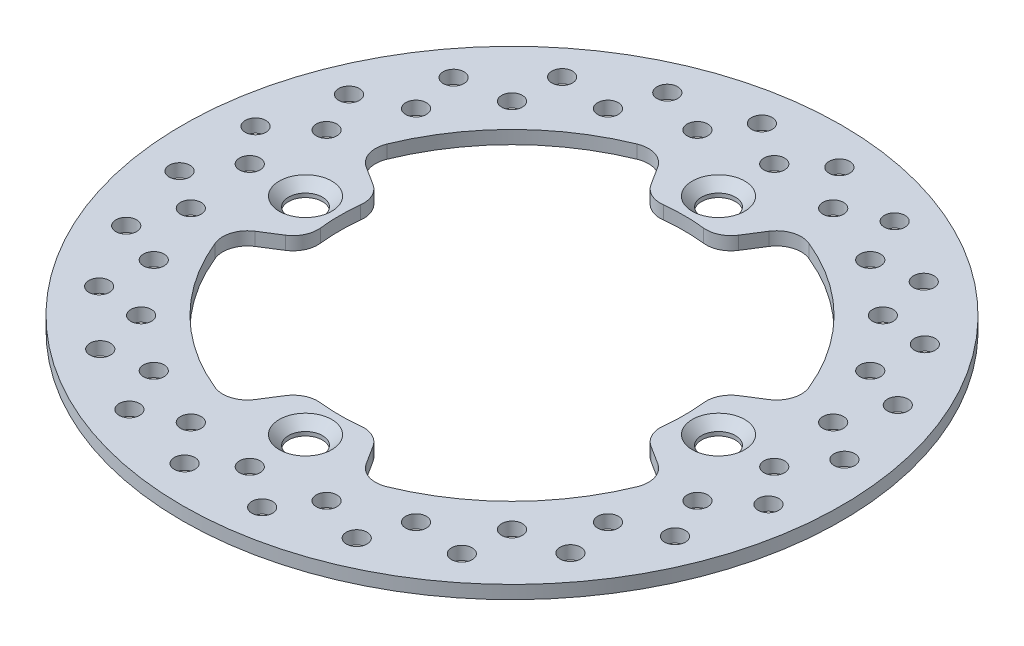
from build123d import *

# Parameters (mm, degrees)
SKETCH1_R                                 = 101.346
SKETCH1_R_2                               = 5.207
BOSS_EXTRUDE1_DEPTH                       = 4.064
CSK_FOR_0_FLAT_HEAD_MACHINE_SCREW_2_COUNT = 2
CSK_FOR_0_FLAT_HEAD_MACHINE_SCREW_2_PITCH = 89.802561211
CSK_FOR_0_FLAT_HEAD_MACHINE_SCREW_3_COUNT = 2
CSK_FOR_0_FLAT_HEAD_MACHINE_SCREW_3_PITCH = 127
CSK_FOR_0_FLAT_HEAD_MACHINE_SCREW_4_COUNT = 2
CSK_FOR_0_FLAT_HEAD_MACHINE_SCREW_4_PITCH = 89.802561211
SKETCH5_R                                 = 3.175
CUT_EXTRUDE1_DEPTH                        = 144.382493802
CIRPATTERN1_COUNT                         = 24


with BuildPart() as part:
    # Sketch1 → Boss-Extrude1 (new body)
    with BuildSketch(Plane(origin=(0, 0, 0), x_dir=(1, 0, 0), z_dir=(0, 1, 0))):
        with Locations(Location((0, 0, 0), (0, 0, 270))):
            Circle(SKETCH1_R)
        with Locations(Location((-63.5, 0, 0), (0, 0, 270))):
            Circle(SKETCH1_R_2, mode=Mode.SUBTRACT)
        with Locations(Location((0, -63.5, 0), (0, 0, 270))):
            Circle(SKETCH1_R_2, mode=Mode.SUBTRACT)
        with Locations(Location((63.5, 0, 0), (0, 0, 270))):
            Circle(SKETCH1_R_2, mode=Mode.SUBTRACT)
        with Locations(Location((0, 63.5, 0), (0, 0, 270))):
            Circle(SKETCH1_R_2, mode=Mode.SUBTRACT)
        with BuildLine():
            ThreePointArc((64.881683525, 26.382546942), (49.526112508, 49.526112508), (26.382546942, 64.881683525))
            ThreePointArc((26.382546942, 64.881683525), (21.186364668, 65.079276457), (17.073311073, 61.897744859))
            Line((17.073311073, 61.897744859), (13.481082332, 56.221349199))
            ThreePointArc((13.481082332, 56.221349199), (10.323291769, 53.41878705), (6.158167064, 52.72760543))
            ThreePointArc((6.158167064, 52.72760543), (0, 53.086), (-6.158167064, 52.72760543))
            ThreePointArc((-6.158167064, 52.72760543), (-10.323291769, 53.41878705), (-13.481082332, 56.221349199))
            Line((-13.481082332, 56.221349199), (-17.073311073, 61.897744859))
            ThreePointArc((-17.073311073, 61.897744859), (-21.186364668, 65.079276457), (-26.382546942, 64.881683525))
            ThreePointArc((-26.382546942, 64.881683525), (-49.526112508, 49.526112508), (-64.881683525, 26.382546942))
            ThreePointArc((-64.881683525, 26.382546942), (-65.079276457, 21.186364668), (-61.897744859, 17.073311073))
            Line((-61.897744859, 17.073311073), (-56.221349199, 13.481082332))
            ThreePointArc((-56.221349199, 13.481082332), (-53.41878705, 10.323291769), (-52.72760543, 6.158167064))
            ThreePointArc((-52.72760543, 6.158167064), (-53.086, 0), (-52.72760543, -6.158167064))
            ThreePointArc((-52.72760543, -6.158167064), (-53.41878705, -10.323291769), (-56.221349199, -13.481082332))
            Line((-56.221349199, -13.481082332), (-61.897744859, -17.073311073))
            ThreePointArc((-61.897744859, -17.073311073), (-65.079276457, -21.186364668), (-64.881683525, -26.382546942))
            ThreePointArc((-64.881683525, -26.382546942), (-49.526112508, -49.526112508), (-26.382546942, -64.881683525))
            ThreePointArc((-26.382546942, -64.881683525), (-21.186364668, -65.079276457), (-17.073311073, -61.897744859))
            Line((-17.073311073, -61.897744859), (-13.481082332, -56.221349199))
            ThreePointArc((-13.481082332, -56.221349199), (-10.323291769, -53.41878705), (-6.158167064, -52.72760543))
            ThreePointArc((-6.158167064, -52.72760543), (0, -53.086), (6.158167064, -52.72760543))
            ThreePointArc((6.158167064, -52.72760543), (10.323291769, -53.41878705), (13.481082332, -56.221349199))
            Line((13.481082332, -56.221349199), (17.073311073, -61.897744859))
            ThreePointArc((17.073311073, -61.897744859), (21.186364668, -65.079276457), (26.382546942, -64.881683525))
            ThreePointArc((26.382546942, -64.881683525), (49.526112508, -49.526112508), (64.881683525, -26.382546942))
            ThreePointArc((64.881683525, -26.382546942), (65.079276457, -21.186364668), (61.897744859, -17.073311073))
            Line((61.897744859, -17.073311073), (56.221349199, -13.481082332))
            ThreePointArc((56.221349199, -13.481082332), (53.41878705, -10.323291769), (52.72760543, -6.158167064))
            ThreePointArc((52.72760543, -6.158167064), (53.086, 0), (52.72760543, 6.158167064))
            ThreePointArc((52.72760543, 6.158167064), (53.41878705, 10.323291769), (56.221349199, 13.481082332))
            Line((56.221349199, 13.481082332), (61.897744859, 17.073311073))
            ThreePointArc((61.897744859, 17.073311073), (65.079276457, 21.186364668), (64.881683525, 26.382546942))
        make_face(mode=Mode.SUBTRACT)
    extrude(amount=BOSS_EXTRUDE1_DEPTH)

    # Sketch4 → CSK for #0 Flat Head Machine Screw (100)1 (revolve, cut)
    with BuildSketch(Plane(origin=(0, 4.064, -63.5), x_dir=(0, 0, 1), z_dir=(1, 0, 0))):
        Polygon((0, 0), (0, 4.064), (5.08, 4.064), (5.08, 2.9845), (8.0645, 0), align=None)
    csk_for_0_flat_head_machine_screw_100 = revolve(axis=Axis((0, 10.414, -63.5), (0, -1, 0)), mode=Mode.SUBTRACT)

    # CSK for _0 Flat Head Machine Screw _ 2: CSK for #0 Flat Head Machine Screw (100)1 ×2
    with Locations(*[Vector(0.7071067811865462, 0, 0.7071067811865488) * (i * CSK_FOR_0_FLAT_HEAD_MACHINE_SCREW_2_PITCH) for i in range(1, CSK_FOR_0_FLAT_HEAD_MACHINE_SCREW_2_COUNT)]):
        add(csk_for_0_flat_head_machine_screw_100, mode=Mode.SUBTRACT)

    # CSK for _0 Flat Head Machine Screw _ 3: CSK for #0 Flat Head Machine Screw (100)1 ×2
    with Locations(*[(0, 0, i * CSK_FOR_0_FLAT_HEAD_MACHINE_SCREW_3_PITCH) for i in range(1, CSK_FOR_0_FLAT_HEAD_MACHINE_SCREW_3_COUNT)]):
        add(csk_for_0_flat_head_machine_screw_100, mode=Mode.SUBTRACT)

    # CSK for _0 Flat Head Machine Screw _ 4: CSK for #0 Flat Head Machine Screw (100)1 ×2
    with Locations(*[Vector(-0.7071067811865512, 0, 0.7071067811865438) * (i * CSK_FOR_0_FLAT_HEAD_MACHINE_SCREW_4_PITCH) for i in range(1, CSK_FOR_0_FLAT_HEAD_MACHINE_SCREW_4_COUNT)]):
        add(csk_for_0_flat_head_machine_screw_100, mode=Mode.SUBTRACT)

    # Sketch5 → Cut-Extrude1 (cut, through all)
    with BuildSketch(Plane(origin=(0, 4.064, 0), x_dir=(1, 0, 0), z_dir=(0, 1, 0))):
        with Locations(Location((80.645, 0, 0), (0, 0, 270))):
            Circle(SKETCH5_R)
        with Locations(Location((89.535, 12.7, 0), (0, 0, 270))):
            Circle(SKETCH5_R)
    cut_extrude1 = extrude(amount=-CUT_EXTRUDE1_DEPTH, mode=Mode.SUBTRACT)

    # CirPattern1: Cut-Extrude1 ×24 about axis
    cirpattern1_axis = Axis((0, 0, 0), (0, 1, 0))
    for i in range(1, CIRPATTERN1_COUNT):
        add(cut_extrude1.rotate(cirpattern1_axis, i * 360 / CIRPATTERN1_COUNT), mode=Mode.SUBTRACT)


solid = part.part
